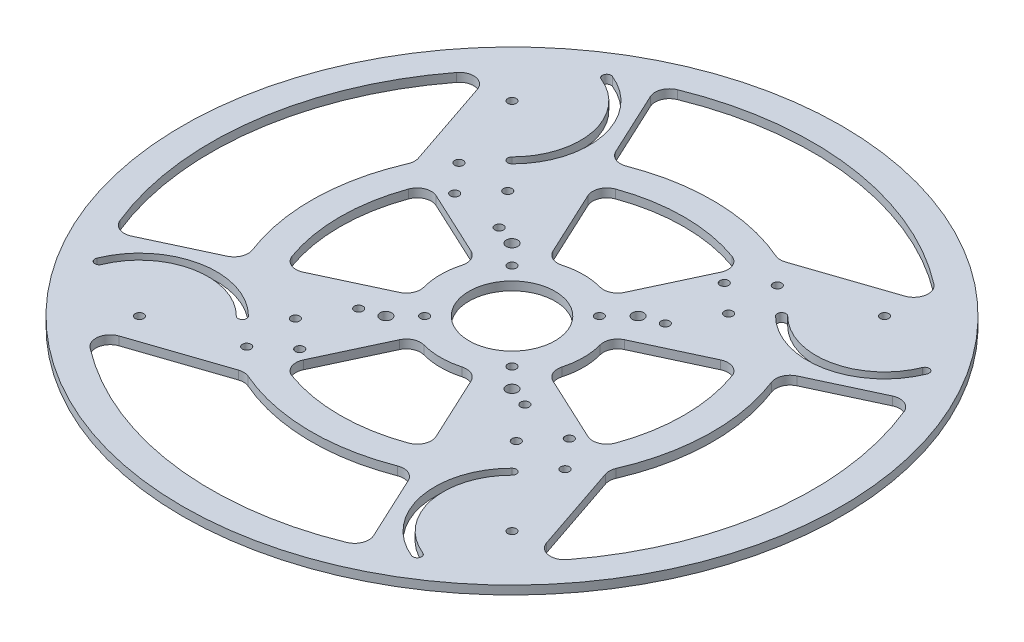
from build123d import *

# Parameters (mm, degrees)
SKETCH1_R           = 115
SKETCH1_R_2         = 1.5
SKETCH1_R_3         = 2
SKETCH1_R_4         = 15
BOSS_EXTRUDE3_DEPTH = 3


with BuildPart() as part:
    # Sketch1 → Boss-Extrude3 (new body)
    with BuildSketch(Plane(origin=(0, 0, 0), x_dir=(1, 0, 0), z_dir=(0, 1, 0))):
        with Locations(Location((0, 0, 0), (0, 0, 270))):
            Circle(SKETCH1_R)
        with Locations(Location((-65, 65, 0), (0, 0, 270))):
            Circle(SKETCH1_R_2, mode=Mode.SUBTRACT)
        with Locations(Location((-47.039487758, 27.039487758, 0), (0, 0, 270))):
            Circle(SKETCH1_R_2, mode=Mode.SUBTRACT)
        with Locations(Location((65, 65, 0), (0, 0, 270))):
            Circle(SKETCH1_R_2, mode=Mode.SUBTRACT)
        with Locations(Location((27.039487758, 47.039487758, 0), (0, 0, 270))):
            Circle(SKETCH1_R_2, mode=Mode.SUBTRACT)
        with Locations(Location((15.25, 15.25, 0), (0, 0, 270))):
            Circle(SKETCH1_R_2, mode=Mode.SUBTRACT)
        with Locations(Location((22, 22, 0), (0, 0, 270))):
            Circle(SKETCH1_R_3, mode=Mode.SUBTRACT)
        with Locations(Location((37.039487758, 55.539487758, 0), (0, 0, 270))):
            Circle(SKETCH1_R_2, mode=Mode.SUBTRACT)
        with Locations(Location((37.039487758, 38.539487758, 0), (0, 0, 270))):
            Circle(SKETCH1_R_2, mode=Mode.SUBTRACT)
        with Locations(Location((65, -65, 0), (0, 0, 270))):
            Circle(SKETCH1_R_2, mode=Mode.SUBTRACT)
        with Locations(Location((47.039487758, -27.039487758, 0), (0, 0, 270))):
            Circle(SKETCH1_R_2, mode=Mode.SUBTRACT)
        with Locations(Location((15.25, -15.25, 0), (0, 0, 270))):
            Circle(SKETCH1_R_2, mode=Mode.SUBTRACT)
        with Locations(Location((22, -22, 0), (0, 0, 270))):
            Circle(SKETCH1_R_3, mode=Mode.SUBTRACT)
        with Locations(Location((55.539487758, -37.039487758, 0), (0, 0, 270))):
            Circle(SKETCH1_R_2, mode=Mode.SUBTRACT)
        with Locations(Location((38.539487758, -37.039487758, 0), (0, 0, 270))):
            Circle(SKETCH1_R_2, mode=Mode.SUBTRACT)
        with Locations(Location((-65, -65, 0), (0, 0, 270))):
            Circle(SKETCH1_R_2, mode=Mode.SUBTRACT)
        with Locations(Location((0, 0, 0), (0, 0, 270))):
            Circle(SKETCH1_R_4, mode=Mode.SUBTRACT)
        with Locations(Location((-15.25, 15.25, 0), (0, 0, 270))):
            Circle(SKETCH1_R_2, mode=Mode.SUBTRACT)
        with Locations(Location((-22, 22, 0), (0, 0, 270))):
            Circle(SKETCH1_R_3, mode=Mode.SUBTRACT)
        with Locations(Location((-55.539487758, 37.039487758, 0), (0, 0, 270))):
            Circle(SKETCH1_R_2, mode=Mode.SUBTRACT)
        with Locations(Location((-27.039487758, -47.039487758, 0), (0, 0, 270))):
            Circle(SKETCH1_R_2, mode=Mode.SUBTRACT)
        with Locations(Location((-15.25, -15.25, 0), (0, 0, 270))):
            Circle(SKETCH1_R_2, mode=Mode.SUBTRACT)
        with Locations(Location((-22, -22, 0), (0, 0, 270))):
            Circle(SKETCH1_R_3, mode=Mode.SUBTRACT)
        with Locations(Location((-37.039487758, -55.539487758, 0), (0, 0, 270))):
            Circle(SKETCH1_R_2, mode=Mode.SUBTRACT)
        with Locations(Location((-37.039487758, -38.539487758, 0), (0, 0, 270))):
            Circle(SKETCH1_R_2, mode=Mode.SUBTRACT)
        with Locations(Location((29, 24.5, 0), (0, 0, 90))):
            Circle(SKETCH1_R_2, mode=Mode.SUBTRACT)
        with Locations(Location((29, -24.5, 0), (0, 0, 270))):
            Circle(SKETCH1_R_2, mode=Mode.SUBTRACT)
        with Locations(Location((-29, -24.5, 0), (0, 0, 90))):
            Circle(SKETCH1_R_2, mode=Mode.SUBTRACT)
        with Locations(Location((-29, 24.5, 0), (0, 0, 270))):
            Circle(SKETCH1_R_2, mode=Mode.SUBTRACT)
        with Locations(Location((-38.539487758, 37.039487758, 0), (0, 0, 270))):
            Circle(SKETCH1_R_2, mode=Mode.SUBTRACT)
        with BuildLine():
            Line((26.808945881, 12.501216771), (49.6405219, 23.147755517))
            ThreePointArc((49.6405219, 23.147755517), (53.675730643, 23.232000867), (56.458487137, 20.308599907))
            ThreePointArc((56.458487137, 20.308599907), (60, 0), (56.458487137, -20.308599907))
            ThreePointArc((56.458487137, -20.308599907), (53.675730643, -23.232000867), (49.6405219, -23.147755517))
            Line((49.6405219, -23.147755517), (26.808945881, -12.501216771))
            ThreePointArc((26.808945881, -12.501216771), (24.383041239, -10.066703292), (24.101697658, -6.641398197))
            ThreePointArc((24.101697658, -6.641398197), (25, 0), (24.101697658, 6.641398197))
            ThreePointArc((24.101697658, 6.641398197), (24.383041239, 10.066703292), (26.808945881, 12.501216771))
        make_face(mode=Mode.SUBTRACT)
        with BuildLine():
            Line((67.821864521, 31.625854817), (90.517419336, 42.208965833))
            ThreePointArc((90.517419336, 42.208965833), (94.457574862, 42.331654691), (97.262036177, 39.561298243))
            ThreePointArc((97.262036177, 39.561298243), (104.05397345, -14.063093872), (83.270844776, -63.960662992))
            ThreePointArc((83.270844776, -63.960662992), (78.486399596, -65.847357267), (74.568650349, -62.515425125))
            Line((74.568650349, -62.515425125), (64.070056019, -31.443439938))
            ThreePointArc((64.070056019, -31.443439938), (63.811318327, -29.63450173), (64.219840648, -27.853403152))
            ThreePointArc((64.219840648, -27.853403152), (69.986267395, -1.386497808), (65.272625441, 25.288028156))
            ThreePointArc((65.272625441, 25.288028156), (65.296141705, 28.960167834), (67.821864521, 31.625854817))
        make_face(mode=Mode.SUBTRACT)
        with BuildLine():
            Line((12.501216771, -26.808945881), (23.147755517, -49.6405219))
            ThreePointArc((23.147755517, -49.6405219), (23.232000867, -53.675730643), (20.308599907, -56.458487137))
            ThreePointArc((20.308599907, -56.458487137), (0, -60), (-20.308599907, -56.458487137))
            ThreePointArc((-20.308599907, -56.458487137), (-23.232000867, -53.675730643), (-23.147755517, -49.6405219))
            Line((-23.147755517, -49.6405219), (-12.501216771, -26.808945881))
            ThreePointArc((-12.501216771, -26.808945881), (-10.066703292, -24.383041239), (-6.641398197, -24.101697658))
            ThreePointArc((-6.641398197, -24.101697658), (0, -25), (6.641398197, -24.101697658))
            ThreePointArc((6.641398197, -24.101697658), (10.066703292, -24.383041239), (12.501216771, -26.808945881))
        make_face(mode=Mode.SUBTRACT)
        with BuildLine():
            Line((-26.808945881, -12.501216771), (-49.6405219, -23.147755517))
            ThreePointArc((-49.6405219, -23.147755517), (-53.675730643, -23.232000867), (-56.458487137, -20.308599907))
            ThreePointArc((-56.458487137, -20.308599907), (-60, 0), (-56.458487137, 20.308599907))
            ThreePointArc((-56.458487137, 20.308599907), (-53.675730643, 23.232000867), (-49.6405219, 23.147755517))
            Line((-49.6405219, 23.147755517), (-26.808945881, 12.501216771))
            ThreePointArc((-26.808945881, 12.501216771), (-24.383041239, 10.066703292), (-24.101697658, 6.641398197))
            ThreePointArc((-24.101697658, 6.641398197), (-25, 0), (-24.101697658, -6.641398197))
            ThreePointArc((-24.101697658, -6.641398197), (-24.383041239, -10.066703292), (-26.808945881, -12.501216771))
        make_face(mode=Mode.SUBTRACT)
        with BuildLine():
            Line((-12.501216771, 26.808945881), (-23.147755517, 49.6405219))
            ThreePointArc((-23.147755517, 49.6405219), (-23.232000867, 53.675730643), (-20.308599907, 56.458487137))
            ThreePointArc((-20.308599907, 56.458487137), (0, 60), (20.308599907, 56.458487137))
            ThreePointArc((20.308599907, 56.458487137), (23.232000867, 53.675730643), (23.147755517, 49.6405219))
            Line((23.147755517, 49.6405219), (12.501216771, 26.808945881))
            ThreePointArc((12.501216771, 26.808945881), (10.066703292, 24.383041239), (6.641398197, 24.101697658))
            ThreePointArc((6.641398197, 24.101697658), (0, 25), (-6.641398197, 24.101697658))
            ThreePointArc((-6.641398197, 24.101697658), (-10.066703292, 24.383041239), (-12.501216771, 26.808945881))
        make_face(mode=Mode.SUBTRACT)
        with BuildLine():
            Line((31.625854817, -67.821864521), (42.208965833, -90.517419336))
            ThreePointArc((42.208965833, -90.517419336), (42.331654691, -94.457574862), (39.561298243, -97.262036177))
            ThreePointArc((39.561298243, -97.262036177), (-14.063093872, -104.05397345), (-63.960662992, -83.270844776))
            ThreePointArc((-63.960662992, -83.270844776), (-65.847357267, -78.486399596), (-62.515425125, -74.568650349))
            Line((-62.515425125, -74.568650349), (-31.443439938, -64.070056019))
            ThreePointArc((-31.443439938, -64.070056019), (-29.63450173, -63.811318327), (-27.853403152, -64.219840648))
            ThreePointArc((-27.853403152, -64.219840648), (-1.386497808, -69.986267395), (25.288028156, -65.272625441))
            ThreePointArc((25.288028156, -65.272625441), (28.960167834, -65.296141705), (31.625854817, -67.821864521))
        make_face(mode=Mode.SUBTRACT)
        with BuildLine():
            Line((-67.821864521, -31.625854817), (-90.517419336, -42.208965833))
            ThreePointArc((-90.517419336, -42.208965833), (-94.457574862, -42.331654691), (-97.262036177, -39.561298243))
            ThreePointArc((-97.262036177, -39.561298243), (-104.05397345, 14.063093872), (-83.270844776, 63.960662991))
            ThreePointArc((-83.270844776, 63.960662991), (-78.486399596, 65.847357267), (-74.568650349, 62.515425125))
            Line((-74.568650349, 62.515425125), (-64.070056019, 31.443439938))
            ThreePointArc((-64.070056019, 31.443439938), (-63.811318327, 29.63450173), (-64.219840648, 27.853403152))
            ThreePointArc((-64.219840648, 27.853403152), (-69.986267395, 1.386497808), (-65.272625441, -25.288028156))
            ThreePointArc((-65.272625441, -25.288028156), (-65.296141705, -28.960167834), (-67.821864521, -31.625854817))
        make_face(mode=Mode.SUBTRACT)
        with BuildLine():
            Line((-31.625854817, 67.821864521), (-42.208965833, 90.517419336))
            ThreePointArc((-42.208965833, 90.517419336), (-42.331654691, 94.457574862), (-39.561298243, 97.262036177))
            ThreePointArc((-39.561298243, 97.262036177), (14.063093872, 104.05397345), (63.960662992, 83.270844776))
            ThreePointArc((63.960662992, 83.270844776), (65.847357267, 78.486399596), (62.515425125, 74.568650349))
            Line((62.515425125, 74.568650349), (31.443439938, 64.070056019))
            ThreePointArc((31.443439938, 64.070056019), (29.63450173, 63.811318327), (27.853403152, 64.219840648))
            ThreePointArc((27.853403152, 64.219840648), (1.386497808, 69.986267395), (-25.288028156, 65.272625441))
            ThreePointArc((-25.288028156, 65.272625441), (-28.960167834, 65.296141705), (-31.625854817, 67.821864521))
        make_face(mode=Mode.SUBTRACT)
        with BuildLine():
            ThreePointArc((-45.978827586, 45.978827586), (-38.640025446, 70.362997436), (-54.923082637, 89.941245688))
            ThreePointArc((-54.923082637, 89.941245688), (-56.875768309, 89.112379796), (-56.046902417, 87.159694124))
            ThreePointArc((-56.046902417, 87.159694124), (-41.57979956, 69.764893633), (-48.10014793, 48.10014793))
            ThreePointArc((-48.10014793, 48.10014793), (-48.10014793, 45.978827586), (-45.978827586, 45.978827586))
        make_face(mode=Mode.SUBTRACT)
        with BuildLine():
            ThreePointArc((45.978827586, 45.978827586), (70.362997436, 38.640025446), (89.941245688, 54.923082637))
            ThreePointArc((89.941245688, 54.923082637), (89.112379796, 56.875768309), (87.159694124, 56.046902417))
            ThreePointArc((87.159694124, 56.046902417), (69.764893633, 41.57979956), (48.10014793, 48.10014793))
            ThreePointArc((48.10014793, 48.10014793), (45.978827586, 48.10014793), (45.978827586, 45.978827586))
        make_face(mode=Mode.SUBTRACT)
        with BuildLine():
            ThreePointArc((45.978827586, -45.978827586), (38.640025446, -70.362997436), (54.923082637, -89.941245688))
            ThreePointArc((54.923082637, -89.941245688), (56.875768309, -89.112379796), (56.046902417, -87.159694124))
            ThreePointArc((56.046902417, -87.159694124), (41.57979956, -69.764893633), (48.10014793, -48.10014793))
            ThreePointArc((48.10014793, -48.10014793), (48.10014793, -45.978827586), (45.978827586, -45.978827586))
        make_face(mode=Mode.SUBTRACT)
        with BuildLine():
            ThreePointArc((-45.978827586, -45.978827586), (-70.362997436, -38.640025446), (-89.941245688, -54.923082637))
            ThreePointArc((-89.941245688, -54.923082637), (-89.112379796, -56.875768309), (-87.159694124, -56.046902417))
            ThreePointArc((-87.159694124, -56.046902417), (-69.764893633, -41.57979956), (-48.10014793, -48.10014793))
            ThreePointArc((-48.10014793, -48.10014793), (-45.978827586, -48.10014793), (-45.978827586, -45.978827586))
        make_face(mode=Mode.SUBTRACT)
    extrude(amount=BOSS_EXTRUDE3_DEPTH)


solid = part.part
